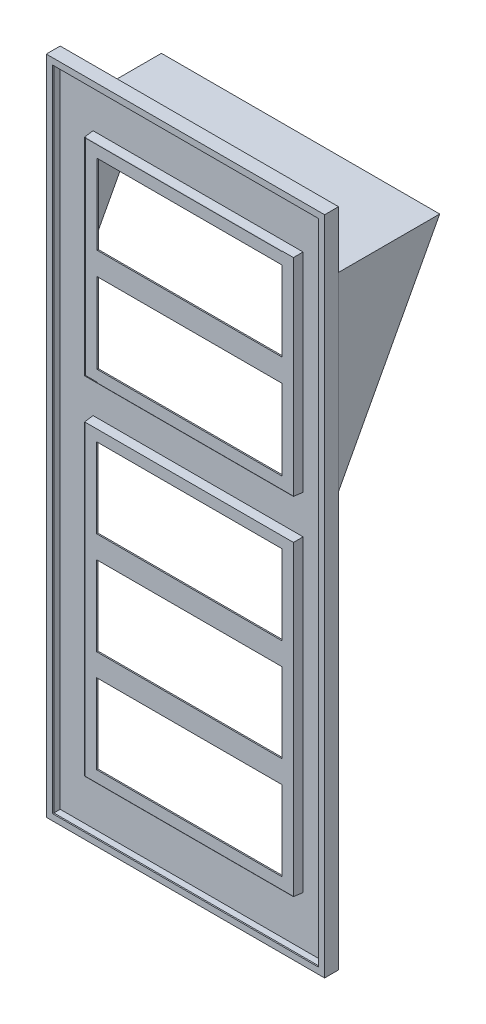
from build123d import *

# Parameters (mm, degrees)
SKETCH_1_W          = 44
SKETCH_1_H          = 104.5
EXTRUDE_1_DEPTH     = 2
SHELL_1_T           = -0.2
SKETCH_2_W          = 32.8
SKETCH_2_H          = 32.5
SKETCH_2_H_2        = 48.3
CUT_EXTRUDE_1_DEPTH = 2
SKETCH_3_W          = 33.2
SKETCH_3_H          = 32.9
SKETCH_3_W_2        = 32.8
SKETCH_3_H_2        = 32.5
SKETCH_3_H_3        = 48.7
SKETCH_3_H_4        = 48.3
EXTRUDE_2_DEPTH     = 1.8
EXTRUDE_2_TAPER     = 4
SKETCH_6_W          = 29.2
SKETCH_6_H          = 12.7
SKETCH_6_H_2        = 12.6
EXTRUDE_3_DEPTH     = 0.2
SKETCH_7_W          = 33
SKETCH_7_H          = 48.5
SKETCH_7_W_2        = 29.3
SKETCH_7_H_2        = 12.6
EXTRUDE_4_DEPTH     = 0.2
EXTRUDE_6_DEPTH     = 44
SKETCH_12_W         = 43.6
SKETCH_12_H         = 29.8
CUT_EXTRUDE_5_DEPTH = 16
SKETCH_13_W         = 44
SKETCH_13_H         = 104.5
SKETCH_13_W_2       = 42
SKETCH_13_H_2       = 102.5
EXTRUDE_7_DEPTH     = 0.2


with BuildPart() as part:
    # 스케치1 → 보스-돌출1 (new body)
    with BuildSketch(Plane.XY):
        with Locations((22, 52.25)):
            Rectangle(SKETCH_1_W, SKETCH_1_H)
    extrude(amount=EXTRUDE_1_DEPTH)

    # 쉘1
    shell_1_openings = [part.faces().sort_by_distance(p)[0] for p in [
        (22, 52.25, 2),
    ]]
    offset(amount=SHELL_1_T, openings=shell_1_openings, kind=Kind.INTERSECTION)

    # 스케치2 → 컷-돌출1 (cut)
    with BuildSketch(Plane.XY.offset(0.2)):
        with Locations((22, 79.25)):
            Rectangle(SKETCH_2_W, SKETCH_2_H)
        with Locations((22, 32.35)):
            Rectangle(SKETCH_2_W, SKETCH_2_H_2)
    extrude(amount=-CUT_EXTRUDE_1_DEPTH, mode=Mode.SUBTRACT)

    # 스케치3 → 보스-돌출2 (add)
    # profile 1 of 2: a face of its own
    with BuildSketch(Plane.XY.offset(0.2)):
        with Locations((22, 79.25)):
            Rectangle(SKETCH_3_W, SKETCH_3_H)
        with Locations((22, 79.25)):
            Rectangle(SKETCH_3_W_2, SKETCH_3_H_2, mode=Mode.SUBTRACT)
    # profile 2 of 2: a face of its own
    with BuildSketch(Plane.XY.offset(0.2)):
        with Locations((22, 32.35)):
            Rectangle(SKETCH_3_W, SKETCH_3_H_3)
        with Locations((22, 32.35)):
            Rectangle(SKETCH_3_W_2, SKETCH_3_H_4, mode=Mode.SUBTRACT)
    extrude(amount=EXTRUDE_2_DEPTH, taper=EXTRUDE_2_TAPER)

    # 스케치7 → 보스-돌출4 (add)
    with BuildSketch(Plane.XY.offset(1.4)):
        with Locations((22, 32.35)):
            Rectangle(SKETCH_7_W, SKETCH_7_H)
        with Locations((22, 16.2)):
            Rectangle(SKETCH_7_W_2, SKETCH_7_H_2, mode=Mode.SUBTRACT)
        with Locations((22, 32.35)):
            Rectangle(SKETCH_7_W_2, SKETCH_7_H_2, mode=Mode.SUBTRACT)
        with Locations((22, 48.5)):
            Rectangle(SKETCH_7_W_2, SKETCH_7_H_2, mode=Mode.SUBTRACT)
    extrude(amount=EXTRUDE_4_DEPTH)

    # 스케치13 → 보스-돌출7 (add)
    with BuildSketch(Plane.XY.offset(2)):
        with Locations((22, 52.25)):
            Rectangle(SKETCH_13_W, SKETCH_13_H)
        with Locations((22, 52.25)):
            Rectangle(SKETCH_13_W_2, SKETCH_13_H_2, mode=Mode.SUBTRACT)
    extrude(amount=EXTRUDE_7_DEPTH)


with BuildPart() as body_2:
    # 스케치6 → 보스-돌출3 (new body)
    with BuildSketch(Plane.XY.offset(1.4)):
        Polygon((5.6, 95.5), (5.6, 63), (7.45, 63), (7.45, 62.9), (38.5, 62.9), (38.5, 95.6), (36.65, 95.6), (36.65, 95.5), align=None)
        with Locations((22.05, 71.1)):
            Rectangle(SKETCH_6_W, SKETCH_6_H, mode=Mode.SUBTRACT)
        with Locations((22.05, 87.35)):
            Rectangle(SKETCH_6_W, SKETCH_6_H_2, mode=Mode.SUBTRACT)
    extrude(amount=EXTRUDE_3_DEPTH)


with BuildPart() as body_3:
    # 스케치11 → 보스-돌출6 (new body)
    with BuildSketch(Plane.ZY):
        Polygon((0, 95.5), (-16, 95.5), (0, 65.5), align=None)
    extrude(amount=-EXTRUDE_6_DEPTH)

    # 스케치12 → 컷-돌출5 (cut)
    with BuildSketch(Plane(origin=(0, 0, 0), x_dir=(-1, 0, 0), z_dir=(0, 0, -1))):
        with Locations((-22, 80.4)):
            Rectangle(SKETCH_12_W, SKETCH_12_H)
    extrude(amount=CUT_EXTRUDE_5_DEPTH, mode=Mode.SUBTRACT)


solid = Compound([part.part, body_2.part, body_3.part])
